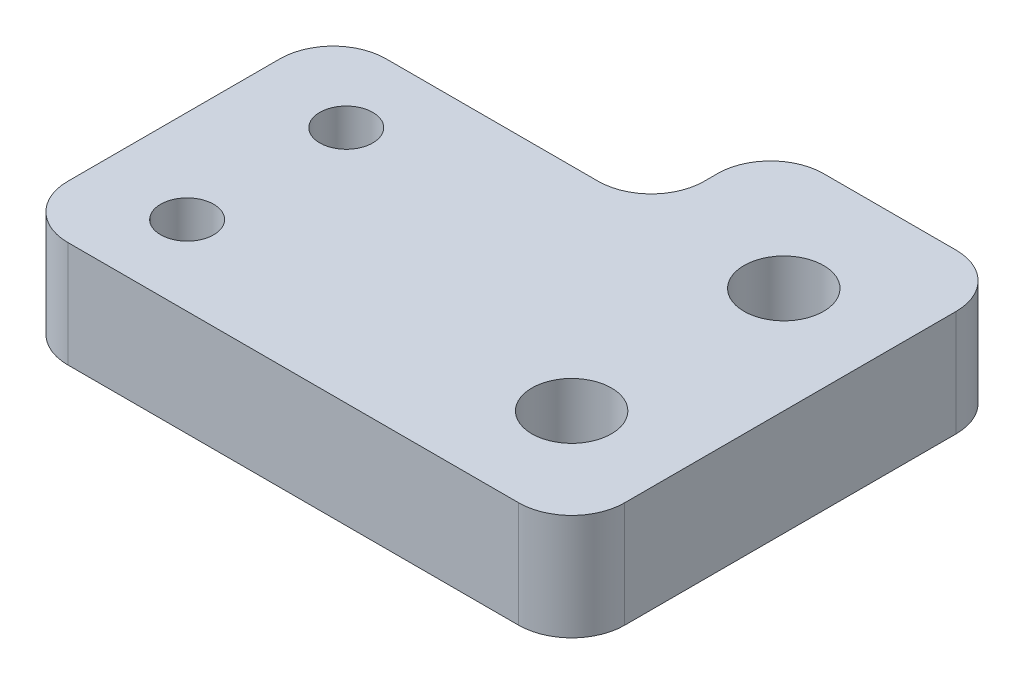
from build123d import *

# Parameters (mm, degrees)
SKETCH_1_R          = 1
SKETCH_1_R_2        = 1.5
EXTRUDE_1_DEPTH     = 4
SKETCH_2_W          = 9
SKETCH_2_H          = 0.5
CUT_EXTRUDE_1_DEPTH = 10
FILLET_1_R          = 2


with BuildPart() as part:
    # 草图1 → 凸台-拉伸1 (new body)
    with BuildSketch(Plane(origin=(0, 0, 0), x_dir=(1, 0, 0), z_dir=(0, 1, 0))):
        Polygon((-14.5, 3.5), (-14.5, -8.5), (14.5, -8.5), (14.5, 8.5), (-2.5, 8.5), (-2.5, 3.5), align=None)
        with Locations(Location((-11, -5.5, 0), (0, 0, 270))):
            Circle(SKETCH_1_R, mode=Mode.SUBTRACT)
        with Locations(Location((2.5, -4.5, 0), (0, 0, 270))):
            Circle(SKETCH_1_R_2, mode=Mode.SUBTRACT)
        with Locations(Location((-11, 0.5, 0), (0, 0, 270))):
            Circle(SKETCH_1_R, mode=Mode.SUBTRACT)
        with Locations(Location((2.5, 3.5, 0), (0, 0, 270))):
            Circle(SKETCH_1_R_2, mode=Mode.SUBTRACT)
    extrude(amount=EXTRUDE_1_DEPTH)

    # 草图2 → 切除-拉伸1 (cut)
    with BuildSketch(Plane(origin=(0, 4, 0), x_dir=(1, 0, 0), z_dir=(0, 1, 0))):
        with Locations((2, 8.25)):
            Rectangle(SKETCH_2_W, SKETCH_2_H)
        Polygon((14.5, -8.5), (14.5, 8.5), (6.5, 8.5), (6.5, 8), (6.5, -8.5), align=None)
    extrude(amount=-CUT_EXTRUDE_1_DEPTH, mode=Mode.SUBTRACT)

    # 圆角1
    fillet_1_edges = [part.edges().sort_by_distance(p)[0] for p in [
        (-14.5, 2, 8.5),
        (-14.5, 2, -3.5),
        (-2.5, 2, -3.5),
        (-2.5, 2, -8),
        (6.5, 2, 8.5),
        (6.5, 2, -8),
    ]]
    fillet(fillet_1_edges, radius=FILLET_1_R)


solid = part.part
